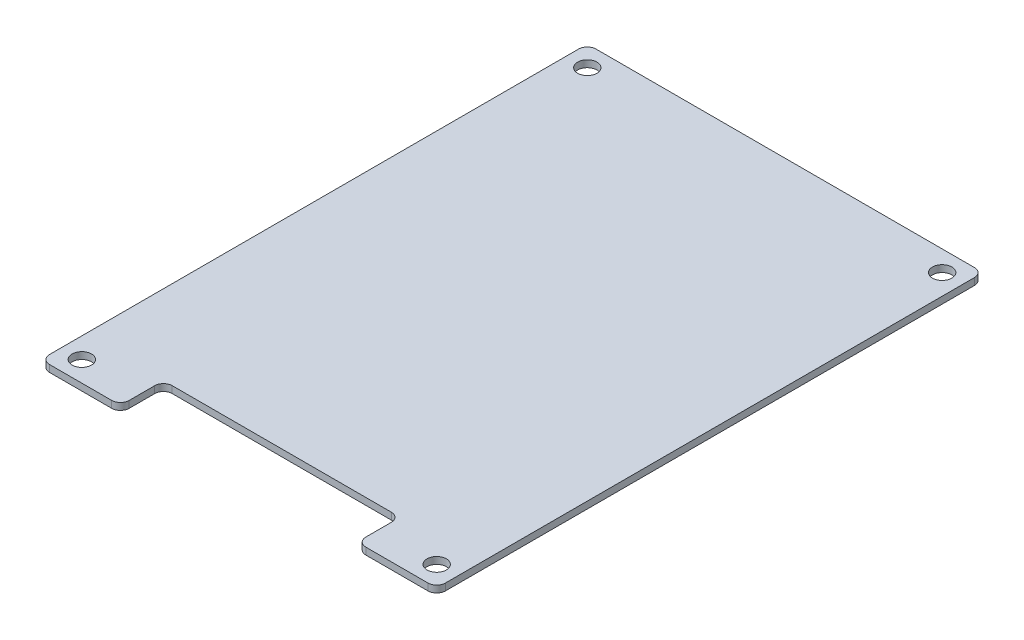
from build123d import *

# Parameters (mm, degrees)
SKETCH1_W                = 92
SKETCH1_H                = 127
BOSS_EXTRUDE1_DEPTH      = 1.6
M4_CLEARANCE_HOLE1_D     = 4.5
M4_CLEARANCE_HOLE1_DEPTH = 50
M4_CLEARANCE_HOLE1_TIP   = 1.351936393
SKETCH4_W                = 55
SKETCH4_H                = 10
CUT_EXTRUDE1_DEPTH       = 1.6
FILLET1_R                = 2.032


with BuildPart() as part:
    # Sketch1 → Boss-Extrude1 (new body)
    with BuildSketch(Plane(origin=(0, 0, 0), x_dir=(1, 0, 0), z_dir=(0, 1, 0))):
        Rectangle(SKETCH1_W, SKETCH1_H)
    extrude(amount=BOSS_EXTRUDE1_DEPTH)

    # M4 Clearance Hole1
    with Locations(Plane(origin=(0, 1.6, 0), x_dir=(1, 0, 0), z_dir=(0, 1, 0))):
        with Locations((-41.2375, 58.7375), (41.2375, 58.7375), (41.2375, -58.7375), (-41.2375, -58.7375)):
            Hole(M4_CLEARANCE_HOLE1_D / 2, depth=M4_CLEARANCE_HOLE1_DEPTH)
            with Locations((0, 0, -(M4_CLEARANCE_HOLE1_DEPTH + M4_CLEARANCE_HOLE1_TIP / 2))):  # 118° drill point
                Cone(0, M4_CLEARANCE_HOLE1_D / 2, M4_CLEARANCE_HOLE1_TIP, mode=Mode.SUBTRACT)

    # Sketch4 → Cut-Extrude1 (cut)
    with BuildSketch(Plane(origin=(0, 1.6, 0), x_dir=(1, 0, 0), z_dir=(0, 1, 0))):
        with Locations((0, -58.5)):
            Rectangle(SKETCH4_W, SKETCH4_H)
    extrude(amount=-CUT_EXTRUDE1_DEPTH, mode=Mode.SUBTRACT)

    # Fillet1
    fillet1_edges = [part.edges().sort_by_distance(p)[0] for p in [
        (27.5, 0.8, 53.5),
        (27.5, 0.8, 63.5),
        (-27.5, 0.8, 63.5),
        (-27.5, 0.8, 53.5),
        (46, 0.8, 63.5),
        (-46, 0.8, 63.5),
        (-46, 0.8, -63.5),
        (46, 0.8, -63.5),
    ]]
    fillet(fillet1_edges, radius=FILLET1_R)


solid = part.part
